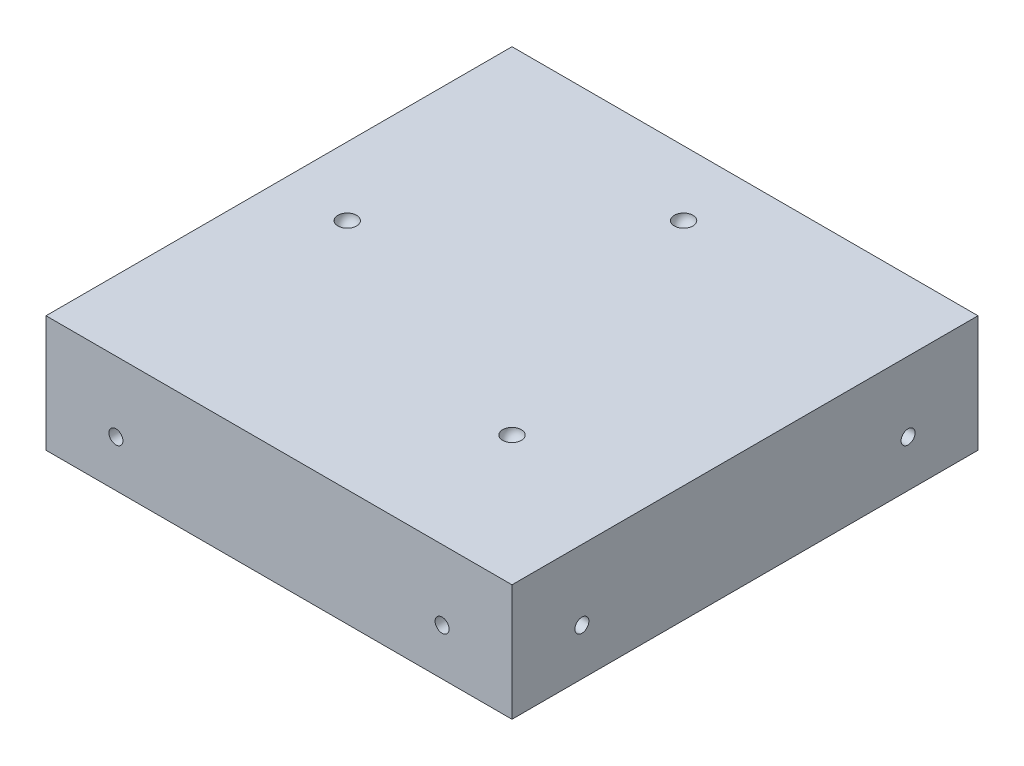
from build123d import *

# Parameters (mm, degrees)
SKETCH1_W           = 100
SKETCH1_H           = 100
BOSS_EXTRUDE1_DEPTH = 25
SKETCH5_R           = 1.5
CUT_EXTRUDE1_DEPTH  = 5
SKETCH6_R           = 1.5
CUT_EXTRUDE2_DEPTH  = 5
CUT_EXTRUDE3_START  = -5
SKETCH7_R           = 1.5
CUT_EXTRUDE3_DEPTH  = 5
CUT_EXTRUDE4_START  = -5
SKETCH8_R           = 1.5
CUT_EXTRUDE4_DEPTH  = 5


with BuildPart() as part:
    # Sketch1 → Boss-Extrude1 (new body)
    with BuildSketch(Plane(origin=(0, 0, 0), x_dir=(1, 0, 0), z_dir=(0, 1, 0))):
        Rectangle(SKETCH1_W, SKETCH1_H)
    extrude(amount=BOSS_EXTRUDE1_DEPTH)

    # Sketch2 → Cut-Revolve7 (revolve, cut)
    with BuildSketch(Plane(origin=(0, 25, 0), x_dir=(1, 0, 0), z_dir=(0, 1, 0))):
        with BuildLine():
            Line((-36.769552622, 1.414213562), (-33.941125497, -1.414213562))
            ThreePointArc((-33.941125497, -1.414213562), (-33.941125497, 1.414213562), (-36.769552622, 1.414213562))
        make_face()
    revolve(axis=Axis((-36.769552622, 25, -1.414213562), (0.7071067811865492, 0, 0.7071067811865459)), mode=Mode.SUBTRACT)

    # Sketch3 → Cut-Revolve8 (revolve, cut)
    with BuildSketch(Plane(origin=(0, 25, 0), x_dir=(1, 0, 0), z_dir=(0, 1, 0))):
        with BuildLine():
            Line((2.147947634, 34.674859569), (-0.680479491, 37.503286693))
            ThreePointArc((-0.680479491, 37.503286693), (2.147947634, 37.503286693), (2.147947634, 34.674859569))
        make_face()
    revolve(axis=Axis((2.147947634, 25, -34.674859569), (-0.7071067811865477, 0, -0.7071067811865474)), mode=Mode.SUBTRACT)

    # Sketch4 → Cut-Revolve9 (revolve, cut)
    with BuildSketch(Plane(origin=(0, 25, 0), x_dir=(1, 0, 0), z_dir=(0, 1, 0))):
        with BuildLine():
            Line((23.582045131, -23.582045131), (20.753618006, -20.753618006))
            ThreePointArc((20.753618006, -20.753618006), (23.582045131, -20.753618006), (23.582045131, -23.582045131))
        make_face()
    revolve(axis=Axis((-50, 25, -50), (0.7071067811865476, 0, 0.7071067811865476)), mode=Mode.SUBTRACT)

    # Sketch5 → Cut-Extrude1 (cut)
    with BuildSketch(Plane.XY.offset(50)):
        with Locations((-35, 10)):
            Circle(SKETCH5_R)
        with Locations((35, 10)):
            Circle(SKETCH5_R)
    extrude(amount=-CUT_EXTRUDE1_DEPTH, mode=Mode.SUBTRACT)

    # Sketch6 → Cut-Extrude2 (cut)
    with BuildSketch(Plane(origin=(50, 0, 0), x_dir=(0, 0, -1), z_dir=(1, 0, 0))):
        with Locations((-35, 10)):
            Circle(SKETCH6_R)
        with Locations((35, 10)):
            Circle(SKETCH6_R)
    extrude(amount=-CUT_EXTRUDE2_DEPTH, mode=Mode.SUBTRACT)

    # Sketch7 → Cut-Extrude3 (cut)
    with BuildSketch(Plane(origin=(0, 0, -50), x_dir=(-1, 0, 0), z_dir=(0, 0, -1)).offset(CUT_EXTRUDE3_START)):
        with Locations(Location((-35, 10, 0), (0, 0, 180))):
            Circle(SKETCH7_R)
        with Locations(Location((35, 10, 0), (0, 0, 180))):
            Circle(SKETCH7_R)
    extrude(amount=CUT_EXTRUDE3_DEPTH, mode=Mode.SUBTRACT)

    # Sketch8 → Cut-Extrude4 (cut)
    with BuildSketch(Plane.ZY.offset(50).offset(CUT_EXTRUDE4_START)):
        with Locations(Location((-35, 10, 0), (0, 0, 180))):
            Circle(SKETCH8_R)
        with Locations(Location((35, 10, 0), (0, 0, 180))):
            Circle(SKETCH8_R)
    extrude(amount=CUT_EXTRUDE4_DEPTH, mode=Mode.SUBTRACT)


solid = part.part
